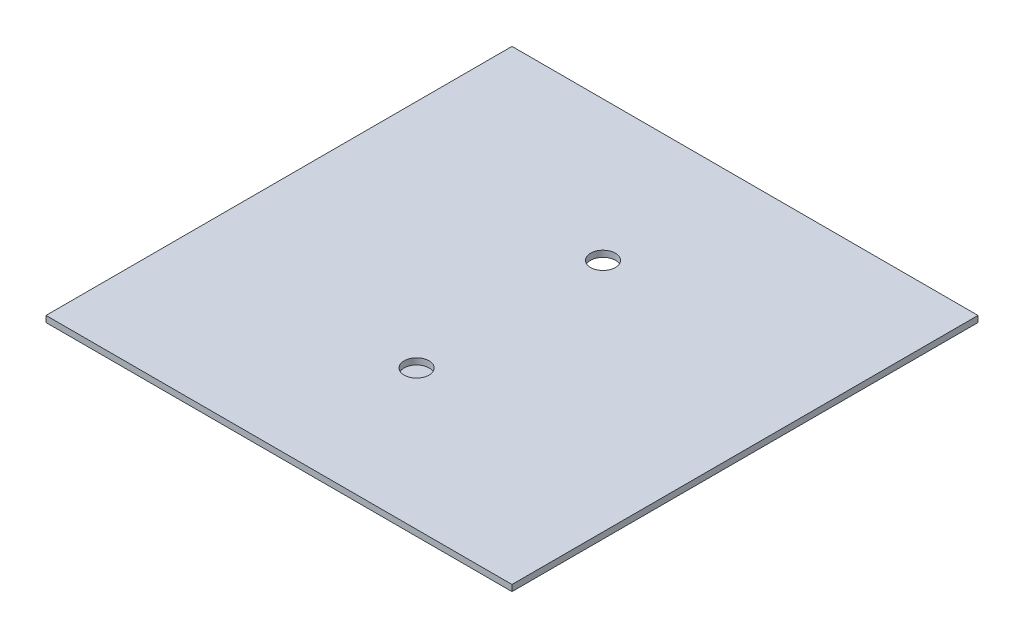
from build123d import *

# Parameters (mm, degrees)
SKETCH1_R                 = 40
BOSS_EXTRUDE1_DEPTH       = 2
F_4_0MM_DOWEL_HOLE1_D     = 4
F_4_0MM_DOWEL_HOLE1_DEPTH = 15
F_4_0MM_DOWEL_HOLE1_TIP   = 1.201721238
SKETCH9_W                 = 15
SKETCH9_H                 = 15
BOSS_EXTRUDE19_DEPTH      = 20
SKETCH10_W                = 150
SKETCH10_H                = 150
BOSS_EXTRUDE20_DEPTH      = 2
SKETCH11_R                = 4
CUT_EXTRUDE1_DEPTH        = 2
FILLET2_R                 = 5


with BuildPart() as part:
    # Sketch1 → Boss-Extrude1 (new body)
    with BuildSketch(Plane(origin=(0, 0, 0), x_dir=(1, 0, 0), z_dir=(0, 1, 0))):
        with Locations(Location((0, 0, 0), (0, 0, 270))):
            Circle(SKETCH1_R)
    extrude(amount=BOSS_EXTRUDE1_DEPTH)

    # Ø4.0mm Dowel Hole1
    with Locations(Plane(origin=(0, 2, 0), x_dir=(1, 0, 0), z_dir=(0, 1, 0))):
        with Locations((0, 30), (0, -30)):
            Hole(F_4_0MM_DOWEL_HOLE1_D / 2, depth=F_4_0MM_DOWEL_HOLE1_DEPTH)
            with Locations((0, 0, -(F_4_0MM_DOWEL_HOLE1_DEPTH + F_4_0MM_DOWEL_HOLE1_TIP / 2))):  # 118° drill point
                Cone(0, F_4_0MM_DOWEL_HOLE1_D / 2, F_4_0MM_DOWEL_HOLE1_TIP, mode=Mode.SUBTRACT)

    # Sketch9 → Boss-Extrude19 (add)
    with BuildSketch(Plane(origin=(0, 2, 0), x_dir=(1, 0, 0), z_dir=(0, 1, 0))):
        with Locations((-31.790584114, 0)):
            Rectangle(SKETCH9_W, SKETCH9_H)
        with Locations((20, -21.547375097)):
            Rectangle(SKETCH9_W, SKETCH9_H)
        with Locations((20, 21.547375097)):
            Rectangle(SKETCH9_W, SKETCH9_H)
    extrude(amount=BOSS_EXTRUDE19_DEPTH)

    # Sketch10 → Boss-Extrude20 (add)
    with BuildSketch(Plane(origin=(0, 22, 0), x_dir=(1, 0, 0), z_dir=(0, 1, 0))):
        with Locations((0.709415886, -0.002124903)):
            Rectangle(SKETCH10_W, SKETCH10_H)
    extrude(amount=BOSS_EXTRUDE20_DEPTH)

    # Sketch11 → Cut-Extrude1 (cut)
    with BuildSketch(Plane.XZ.offset(-22)):
        with Locations(Location((0, 30, 0), (0, 0, 270))):
            Circle(SKETCH11_R)
        with Locations(Location((0, -30, 0), (0, 0, 270))):
            Circle(SKETCH11_R)
    extrude(amount=-CUT_EXTRUDE1_DEPTH, mode=Mode.SUBTRACT)

    # Fillet2
    fillet2_edges = [part.edges().sort_by_distance(p)[0] for p in [
        (-39.290584114, 22, 0),
        (-31.790584114, 22, 7.5),
        (-31.790584114, 22, -7.5),
        (27.5, 22, 21.547375097),
        (20, 22, 29.047375097),
        (20, 22, -29.047375097),
        (27.5, 22, -21.547375097),
    ]]
    fillet(fillet2_edges, radius=FILLET2_R)


solid = part.part
